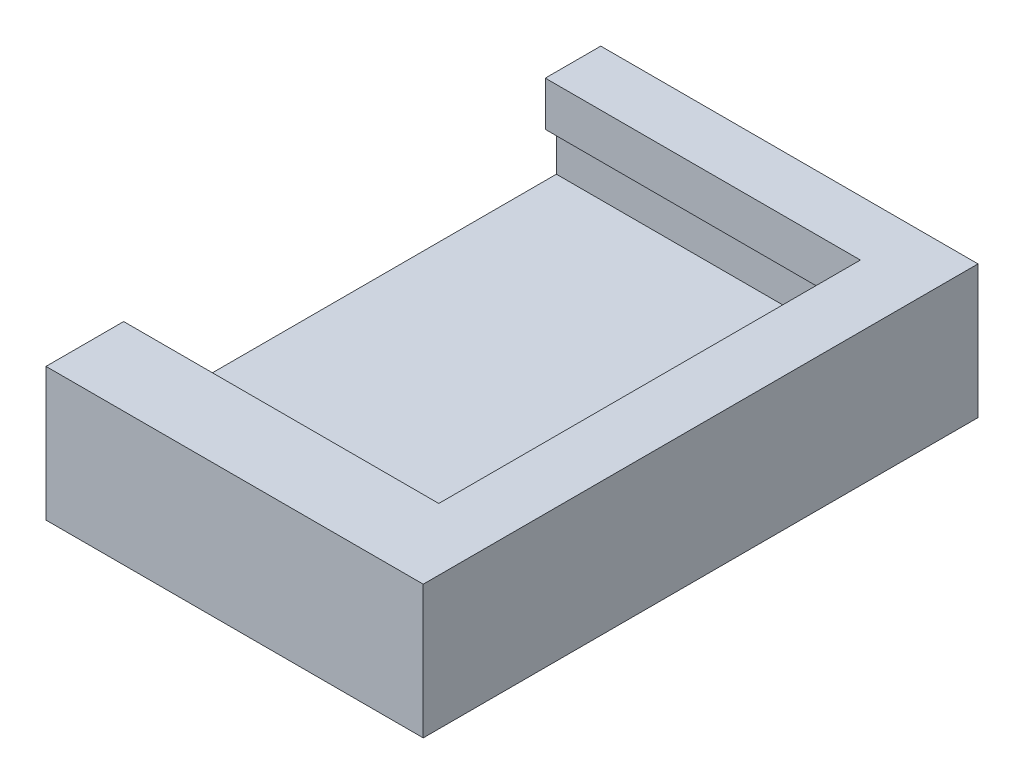
from build123d import *

# Parameters (mm, degrees)
SKETCH1_W           = 24.13
SKETCH1_H           = 31.75
BOSS_EXTRUDE1_DEPTH = 2.54
BOSS_EXTRUDE2_DEPTH = 2.54
SKETCH3_W           = 31.75
SKETCH3_H           = 5.08
CUT_EXTRUDE1_DEPTH  = 2.54
BOSS_EXTRUDE3_DEPTH = 2.54
SKETCH5_R           = 2.5527
BOSS_EXTRUDE4_DEPTH = 2.54


with BuildPart() as part:
    # Sketch1 → Boss-Extrude1 (new body)
    with BuildSketch(Plane(origin=(0, 0, 0), x_dir=(1, 0, 0), z_dir=(0, 1, 0))):
        Rectangle(SKETCH1_W, SKETCH1_H)
    extrude(amount=BOSS_EXTRUDE1_DEPTH)

    # Sketch2 → Boss-Extrude2 (add)
    with BuildSketch(Plane(origin=(0, 2.54, 0), x_dir=(1, 0, 0), z_dir=(0, 1, 0))):
        Polygon((-12.065, 15.875), (-12.065, 13.335), (-9.525, 13.335), (9.525, 13.335), (9.525, -13.335), (-9.525, -13.335), (-12.065, -13.335), (-12.065, -15.875), (12.065, -15.875), (12.065, 15.875), align=None)
    extrude(amount=BOSS_EXTRUDE2_DEPTH)

    # Sketch3 → Cut-Extrude1 (cut)
    with BuildSketch(Plane.ZY.offset(12.065)):
        with Locations((0, 2.54)):
            Rectangle(SKETCH3_W, SKETCH3_H)
    extrude(amount=-CUT_EXTRUDE1_DEPTH, mode=Mode.SUBTRACT)

    # Sketch4 → Boss-Extrude3 (add)
    with BuildSketch(Plane(origin=(0, 5.08, 0), x_dir=(1, 0, 0), z_dir=(0, 1, 0))):
        Polygon((-9.525, 15.875), (-9.525, 12.7), (8.509, 12.7), (8.509, -11.43), (-9.525, -11.43), (-9.525, -15.875), (12.065, -15.875), (12.065, 15.875), align=None)
    extrude(amount=BOSS_EXTRUDE3_DEPTH)

    # Sketch5 → Boss-Extrude4 (add)
    # profile 1 of 2: a face of its own
    with BuildSketch(Plane(origin=(0, 0, 0), x_dir=(-1, 0, 0), z_dir=(0, -1, 0))):
        with BuildLine():
            Line((-12.065, 6.35), (-12.065, -6.35))
            Line((-12.065, -6.35), (-18.415, -6.35))
            ThreePointArc((-18.415, -6.35), (-22.905128061, -4.490128061), (-24.765, 0))
            ThreePointArc((-24.765, 0), (-22.905128061, 4.490128061), (-18.415, 6.35))
            Line((-18.415, 6.35), (-12.065, 6.35))
        make_face()
        with Locations((-18.415, 0)):
            Circle(SKETCH5_R, mode=Mode.SUBTRACT)
    # profile 2 of 2: a face of its own
    with BuildSketch(Plane(origin=(0, 0, 0), x_dir=(-1, 0, 0), z_dir=(0, -1, 0))):
        with BuildLine():
            Line((9.525, 6.35), (15.875, 6.35))
            ThreePointArc((15.875, 6.35), (20.365128061, 4.490128061), (22.225, 0))
            ThreePointArc((22.225, 0), (20.365128061, -4.490128061), (15.875, -6.35))
            Line((15.875, -6.35), (9.525, -6.35))
            Line((9.525, -6.35), (9.525, 6.35))
        make_face()
        with Locations((15.875, 0)):
            Circle(SKETCH5_R, mode=Mode.SUBTRACT)
    extrude(amount=BOSS_EXTRUDE4_DEPTH)


with BuildPart() as boss_extrude4_kept_piece:
    # of the separate pieces the step leaves, the one the design keeps (boss_extrude4_pieces_kept)
    add(part.part.solids().sort_by_distance((12.065, 0, 15.875))[0])


solid = boss_extrude4_kept_piece.part
